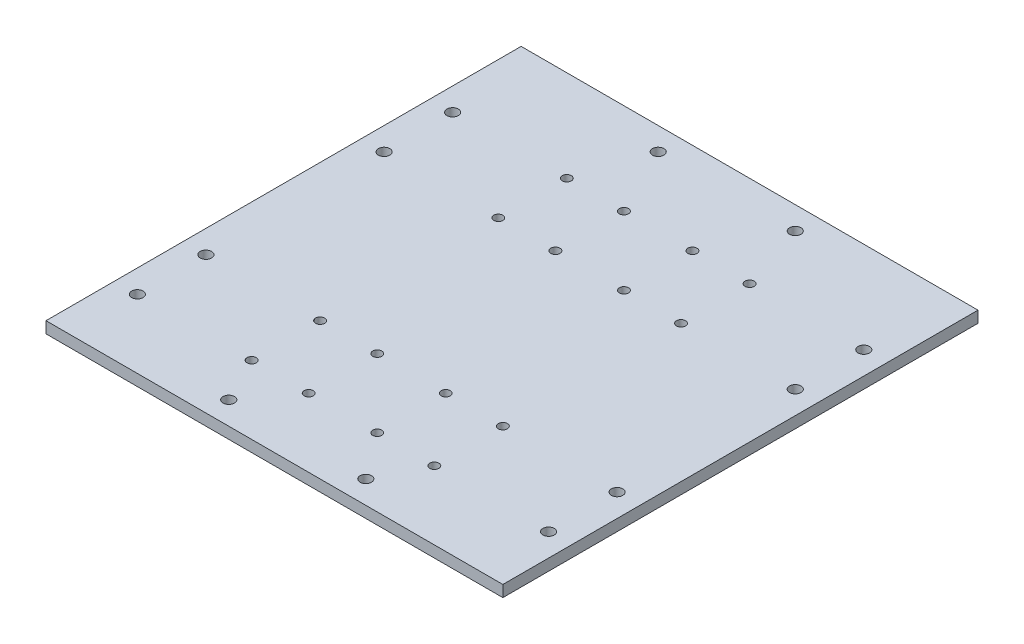
from build123d import *

# Parameters (mm, degrees)
SKETCH_2_W            = 200
SKETCH_2_H            = 208
EXTRUDE_1_DEPTH       = 5
HOLE_WIZARD_4_0_4_1_D = 4
HOLE_WIZARD_5_0_5_1_D = 5


with BuildPart() as part:
    # 草图2 → 凸台-拉伸1 (new body)
    with BuildSketch(Plane(origin=(0, 0, 0), x_dir=(1, 0, 0), z_dir=(0, 1, 0))):
        with Locations((100, 104)):
            Rectangle(SKETCH_2_W, SKETCH_2_H)
    extrude(amount=EXTRUDE_1_DEPTH)

    # Ø4.0 (4) 直径孔1 (through all)
    with Locations(Plane(origin=(0, 5, 0), x_dir=(1, 0, 0), z_dir=(0, 1, 0))):
        with Locations((60, 168), (85, 168), (60, 138), (85, 138), (60, 60), (85, 60), (60, 30), (85, 30), (115, 30), (140, 30), (115, 60), (140, 60), (115, 138), (140, 138), (115, 168), (140, 168)):
            Hole(HOLE_WIZARD_4_0_4_1_D / 2)

    # Ø5.0 (5) 直径孔1 (through all)
    with Locations(Plane(origin=(0, 5, 0), x_dir=(1, 0, 0), z_dir=(0, 1, 0))):
        with Locations((10, 168), (10, 138), (10, 60), (10, 30), (70, 198), (70, 10), (130, 10), (130, 198), (190, 30), (190, 60), (190, 138), (190, 168)):
            Hole(HOLE_WIZARD_5_0_5_1_D / 2)


solid = part.part
